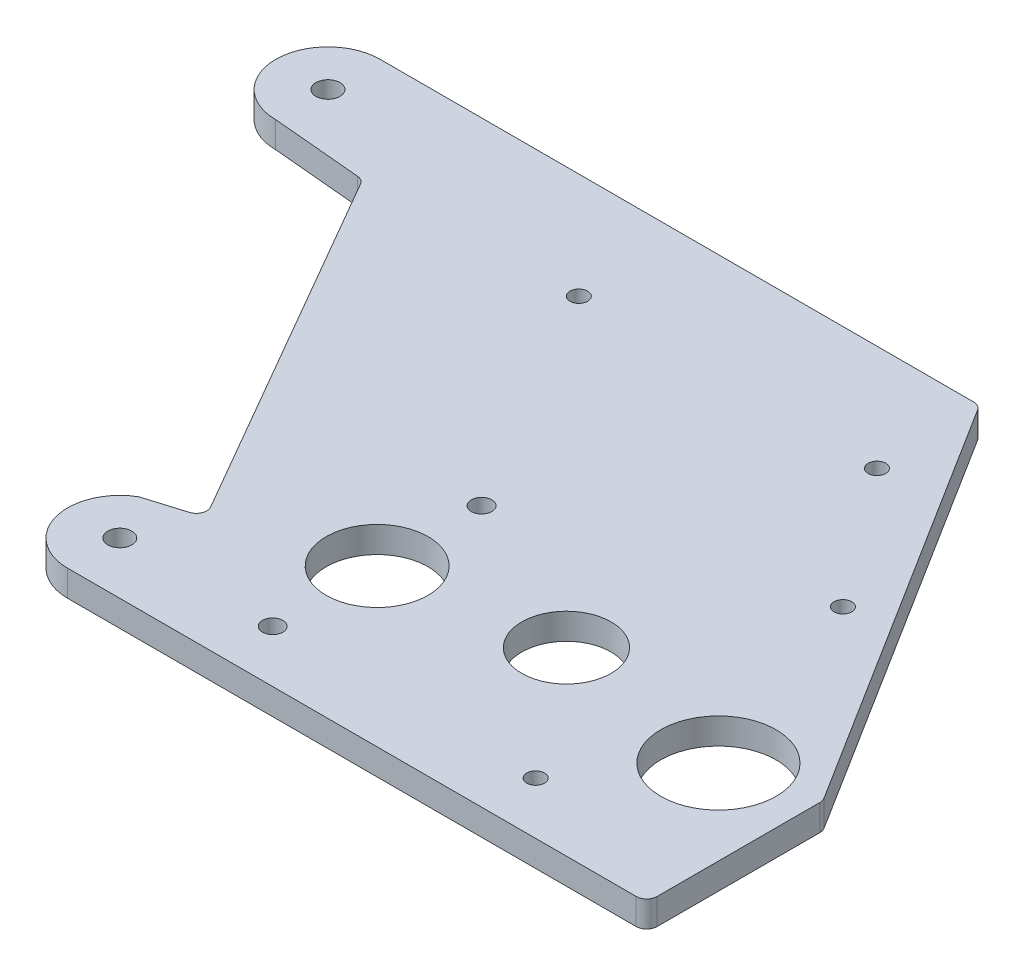
from build123d import *

# Parameters (mm, degrees)
SKETCH1_R           = 2.921
SKETCH1_R_2         = 14.0335
SKETCH1_R_3         = 10.8585
SKETCH1_R_4         = 2.4892
SKETCH1_R_5         = 12.3825
BOSS_EXTRUDE1_DEPTH = 6.35
SKETCH2_W           = 6.35
SKETCH2_H           = 6.35
SKETCH2_H_2         = 16.217729686
SKETCH2_R           = 2.15265
CUT_EXTRUDE2_DEPTH  = 196.570791382
FILLET1_R           = 2.54


with BuildPart() as part:
    # Sketch1 → Boss-Extrude1 (new body)
    with BuildSketch(Plane(origin=(0, 0, 0), x_dir=(1, 0, 0), z_dir=(0, 1, 0))):
        with BuildLine():
            ThreePointArc((-168.788743889, 72.590962133), (-181.488743889, 59.890962122), (-168.788743866, 47.190962133))
            Line((-168.788743866, 47.190962133), (-145.58139547, 45.094655563))
            Line((-145.58139547, 45.094655563), (-93.510572414, -45.094655563))
            Line((-93.510572414, -45.094655563), (-105.98261767, -48.892439505))
            ThreePointArc((-105.98261767, -48.892439505), (-111.899875664, -63.177964006), (-99.63261767, -72.590962133))
            Line((-99.63261767, -72.590962133), (47.56445351, -72.590962133))
            Line((47.56445351, -72.590962133), (47.56445351, 72.590962133))
            Line((47.56445351, 72.590962133), (-168.788743889, 72.590962133))
        make_face()
        with Locations(Location((-168.788743889, 59.890962133, 0), (0, 0, 270))):
            Circle(SKETCH1_R, mode=Mode.SUBTRACT)
        with Locations(Location((20.56425351, -34.490962133, 0), (0, 0, 270))):
            Circle(SKETCH1_R_2, mode=Mode.SUBTRACT)
        with Locations(Location((-22.22178223, -28.671379192, 0), (0, 0, 270))):
            Circle(SKETCH1_R_3, mode=Mode.SUBTRACT)
        with Locations(Location((-62.44294649, -9.090962133, 0), (0, 0, 270))):
            Circle(SKETCH1_R_4, mode=Mode.SUBTRACT)
        with Locations(Location((-62.44294649, -34.490962133, 0), (0, 0, 270))):
            Circle(SKETCH1_R_5, mode=Mode.SUBTRACT)
        with Locations(Location((-62.44294649, -59.890962133, 0), (0, 0, 270))):
            Circle(SKETCH1_R_4, mode=Mode.SUBTRACT)
        with Locations(Location((-99.63261767, -59.890962133, 0), (0, 0, 270))):
            Circle(SKETCH1_R, mode=Mode.SUBTRACT)
    extrude(amount=BOSS_EXTRUDE1_DEPTH)

    # Sketch2 → Cut-Extrude2 (cut, through all)
    with BuildSketch(Plane(origin=(0, 6.35, 0), x_dir=(1, 0, 0), z_dir=(0, 1, 0))):
        Polygon((47.56445351, 66.240962133), (41.21445351, 66.240962133), (41.21445351, 50.023232447), (41.21445351, 43.673232447), (41.21445351, -29.703590933), (47.56445351, -39.813704084), align=None)
        with Locations((44.38945351, 69.415962133)):
            Rectangle(SKETCH2_W, SKETCH2_H)
        with Locations((38.03945351, 58.13209729)):
            Rectangle(SKETCH2_W, SKETCH2_H_2)
        with Locations((38.03945351, 69.415962133)):
            Rectangle(SKETCH2_W, SKETCH2_H)
        Polygon((34.86445351, 72.590962133), (-23.035115437, 72.590962133), (-19.04678223, 66.240962133), (34.86445351, 66.240962133), align=None)
        Polygon((34.86445351, 66.240962133), (-19.04678223, 66.240962133), (-8.860686193, 50.023232447), (34.86445351, 50.023232447), align=None)
        Polygon((34.86445351, 50.023232447), (-8.860686193, 50.023232447), (-4.872352987, 43.673232447), (34.86445351, 43.673232447), align=None)
        with Locations((38.03945351, 46.848232447)):
            Rectangle(SKETCH2_W, SKETCH2_H)
        Polygon((34.86445351, 43.673232447), (-4.872352987, 43.673232447), (10.866061277, 18.615413703), (34.86445351, -19.593477782), align=None)
        with BuildLine():
            Line((41.21445351, 43.673232447), (34.86445351, 43.673232447))
            Line((34.86445351, 43.673232447), (34.86445351, -19.593477782))
            ThreePointArc((34.86445351, -19.593477782), (38.05130715, -23.507624068), (40.193418442, -28.077956276))
            Line((40.193418442, -28.077956276), (41.21445351, -29.703590933))
            Line((41.21445351, -29.703590933), (41.21445351, 43.673232447))
        make_face()
        Polygon((47.56445351, -72.590962133), (47.56445351, -39.813704084), (41.21445351, -29.703590933), (41.21445351, -34.490962133), (41.21445351, -66.240962133), (41.21445351, -72.590962133), align=None)
        with Locations(Location((-94.739455539, 46.848232447, 0), (0, 0, 270))):
            Circle(SKETCH2_R)
        with Locations(Location((-22.22178223, 46.848232447, 0), (0, 0, 270))):
            Circle(SKETCH2_R)
        with Locations(Location((2.800077171, 13.549298288, 0), (0, 0, 270))):
            Circle(SKETCH2_R)
        with Locations(Location((1.51425351, -59.890962133, 0), (0, 0, 270))):
            Circle(SKETCH2_R)
        with BuildLine():
            ThreePointArc((40.193418442, -28.077956276), (38.05130715, -23.507624068), (34.86445351, -19.593477782))
            Line((34.86445351, -19.593477782), (40.193418442, -28.077956276))
        make_face()
    extrude(amount=-CUT_EXTRUDE2_DEPTH, mode=Mode.SUBTRACT)

    # Fillet1
    fillet1_edges = [part.edges().sort_by_distance(p)[0] for p in [
        (-93.510572414, 3.175, 45.094655563),
        (-145.58139547, 3.175, -45.094655563),
        (-23.035115437, 3.175, -72.590962133),
        (41.21445351, 3.175, 72.590962133),
        (41.21445351, 3.175, 29.703590933),
    ]]
    fillet(fillet1_edges, radius=FILLET1_R)


solid = part.part
